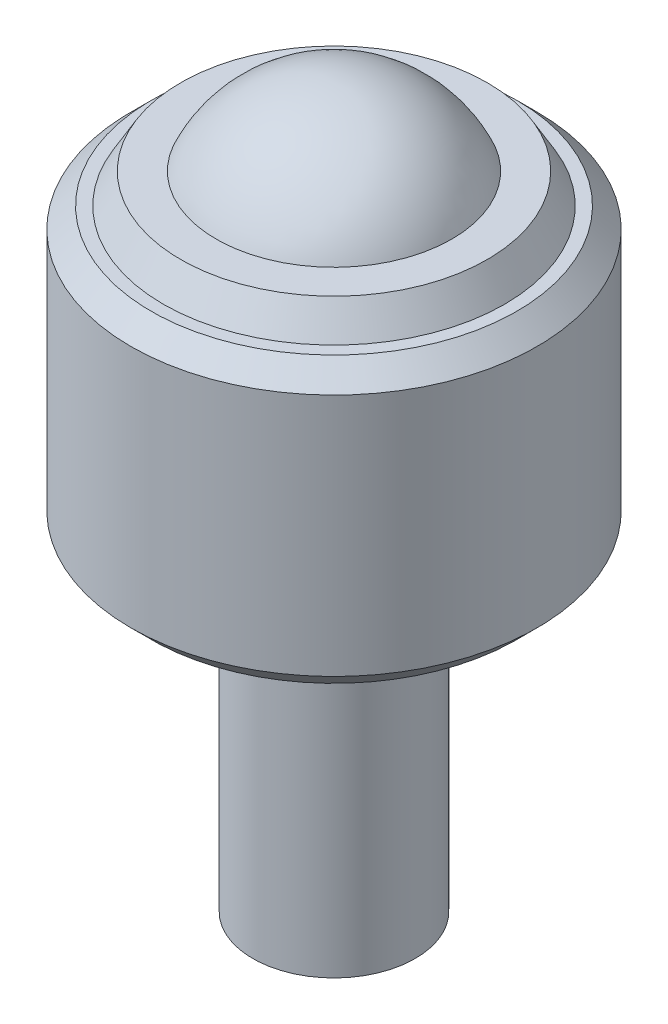
from build123d import *


with BuildPart() as part:
    # Sketch1 → Revolve1 (revolve)
    with BuildSketch(Plane.XY, mode=Mode.PRIVATE) as revolve1_sk:
        with BuildLine():
            Line((5.628277432, 36.754630752), (7.372072988, 36.754630752))
            Line((7.372072988, 36.754630752), (8.226027868, 35.274630752))
            Line((8.226027868, 35.274630752), (8.826027868, 35.274630752))
            Line((8.826027868, 35.274630752), (9.826027868, 34.274630752))
            Line((9.826027868, 34.274630752), (9.826027868, 22.274630752))
            Line((9.826027868, 22.274630752), (8.826027868, 21.274630752))
            Line((8.826027868, 21.274630752), (4.826027868, 21.274630752))
            ThreePointArc((4.826027868, 21.274630752), (4.118921087, 20.981737533), (3.826027868, 20.274630752))
            Line((3.826027868, 20.274630752), (3.826027868, 5.174630752))
            Line((3.826027868, 5.174630752), (-0.173972132, 5.174630752))
            Line((-0.173972132, 5.174630752), (-0.173972132, 40.524630752))
            ThreePointArc((-0.173972132, 40.524630752), (3.285760517, 39.499360792), (5.628277432, 36.754630752))
        make_face()
    revolve(revolve1_sk.sketch.rotate(Axis((-0.173972132, 0, 0), (0, 1, 0)), 90), axis=Axis((-0.173972132, 0, 0), (0, 1, 0)))


solid = part.part
